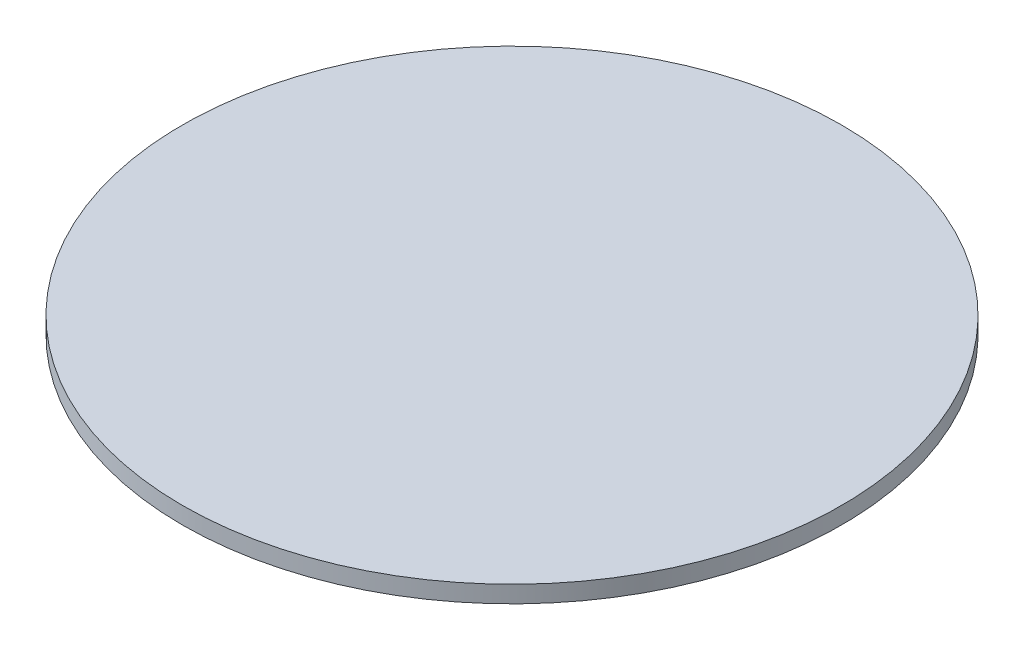
from build123d import *

# Parameters (mm, degrees)
SKETCH1_R           = 38.8
BOSS_EXTRUDE1_DEPTH = 2


with BuildPart() as part:
    # Sketch1 → Boss-Extrude1 (new body)
    with BuildSketch(Plane(origin=(0, 0, 0), x_dir=(1, 0, 0), z_dir=(0, 1, 0))):
        with Locations(Location((0, 0, 0), (0, 0, 270))):
            Circle(SKETCH1_R)
    extrude(amount=BOSS_EXTRUDE1_DEPTH)


solid = part.part
